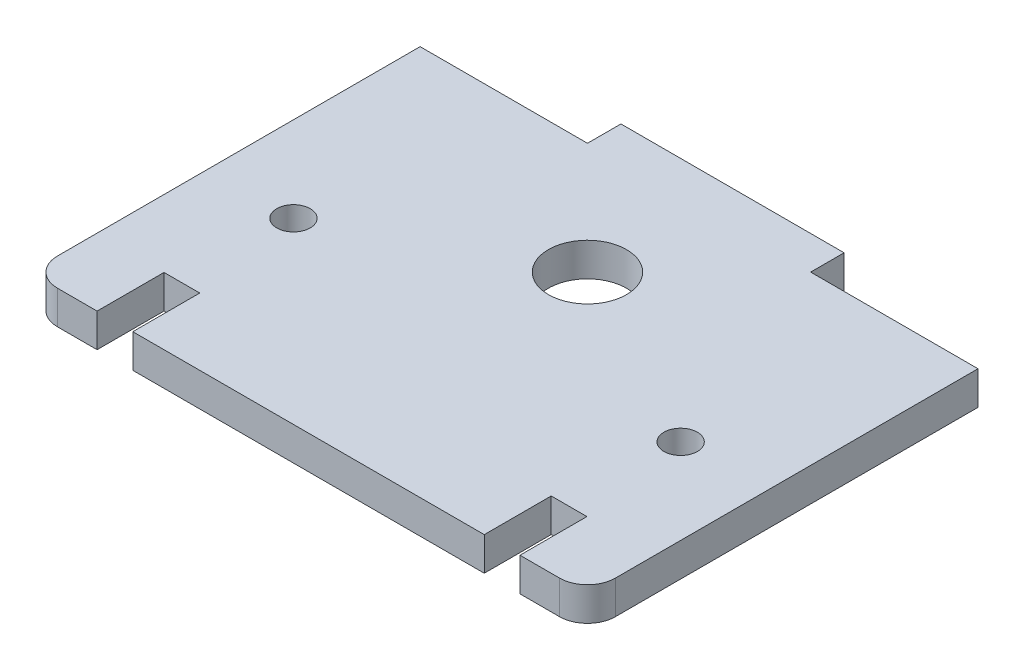
from build123d import *

# Parameters (mm, degrees)
CROQUIS1_R              = 1.5
CROQUIS1_R_2            = 3.5
SALIENTE_EXTRUIR1_DEPTH = 3
CROQUIS4_W              = 20
CROQUIS4_H              = 3
SALIENTE_EXTRUIR2_DEPTH = 3


with BuildPart() as part:
    # Croquis1 → Saliente-Extruir1 (new body)
    with BuildSketch(Plane(origin=(0, 0, 0), x_dir=(1, 0, 0), z_dir=(0, 1, 0))):
        with BuildLine():
            Line((22.5, -17.5), (18.95, -17.5))
            Line((18.95, -17.5), (18.95, -11.5))
            Line((18.95, -11.5), (15.75, -11.5))
            Line((15.75, -11.5), (15.75, -17.5))
            Line((15.75, -17.5), (-15.75, -17.5))
            Line((-15.75, -17.5), (-15.75, -11.5))
            Line((-15.75, -11.5), (-18.95, -11.5))
            Line((-18.95, -11.5), (-18.95, -17.5))
            Line((-18.95, -17.5), (-22.5, -17.5))
            ThreePointArc((-22.5, -17.5), (-24.267766953, -16.767766953), (-25, -15))
            Line((-25, -15), (-25, 17.5))
            Line((-25, 17.5), (25, 17.5))
            Line((25, 17.5), (25, -15))
            ThreePointArc((25, -15), (24.267766953, -16.767766953), (22.5, -17.5))
        make_face()
        with Locations(Location((-17.35, -1.5, 0), (0, 0, 270))):
            Circle(CROQUIS1_R, mode=Mode.SUBTRACT)
        with Locations(Location((17.35, -1.5, 0), (0, 0, 90))):
            Circle(CROQUIS1_R, mode=Mode.SUBTRACT)
        with Locations(Location((0, 7.5, 0), (0, 0, 270))):
            Circle(CROQUIS1_R_2, mode=Mode.SUBTRACT)
    extrude(amount=SALIENTE_EXTRUIR1_DEPTH)

    # Croquis4 → Saliente-Extruir2 (add)
    with BuildSketch(Plane(origin=(0, 0, -17.5), x_dir=(-1, 0, 0), z_dir=(0, 0, -1))):
        with Locations((0, 1.5)):
            Rectangle(CROQUIS4_W, CROQUIS4_H)
    extrude(amount=SALIENTE_EXTRUIR2_DEPTH)


solid = part.part
